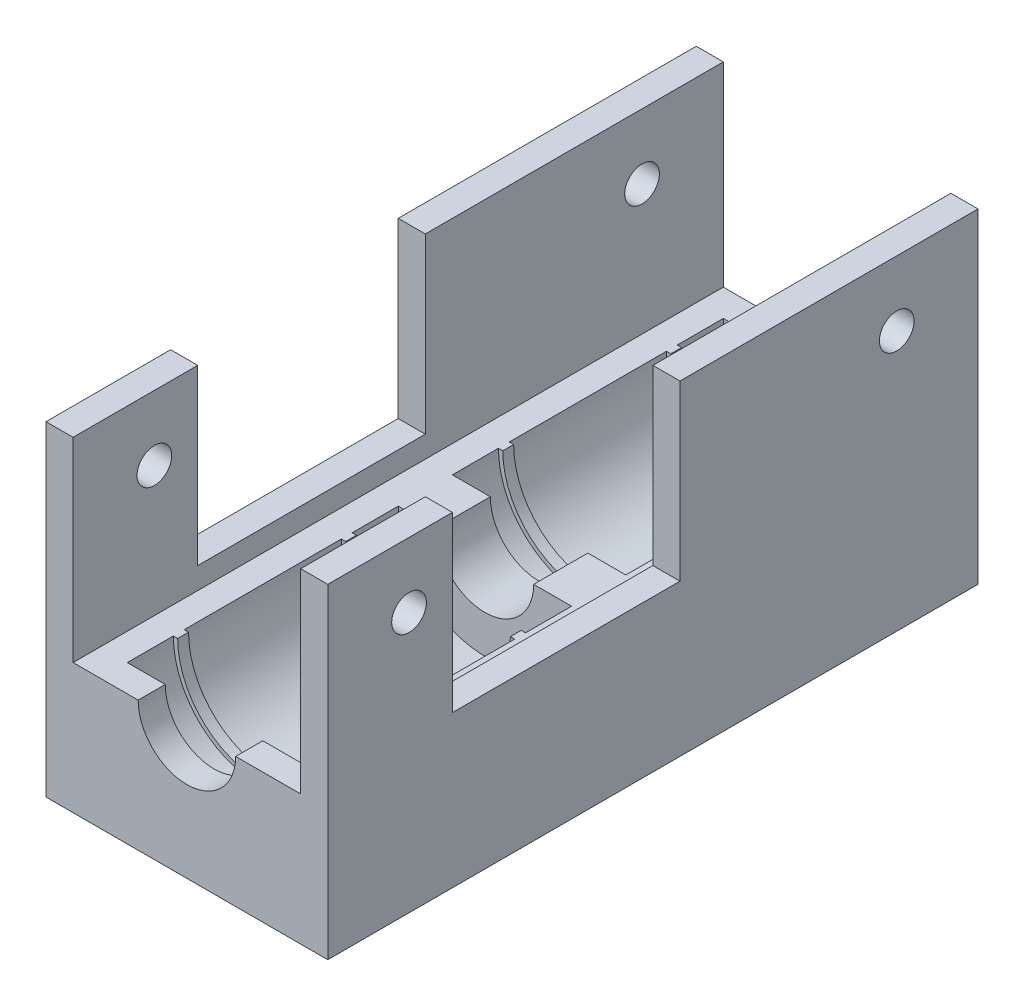
from build123d import *

# Parameters (mm, degrees)
SKETCH1_W           = 21
SKETCH1_H           = 60
BOSS_EXTRUDE1_DEPTH = 12
BOSS_EXTRUDE2_DEPTH = 2.5
SKETCH7_R           = 1.6
CUT_EXTRUDE2_DEPTH  = 50.759421218


with BuildPart() as part:
    # Sketch1 → Boss-Extrude1 (new body)
    with BuildSketch(Plane(origin=(0, 0, 0), x_dir=(1, 0, 0), z_dir=(0, 1, 0))):
        Rectangle(SKETCH1_W, SKETCH1_H)
    extrude(amount=BOSS_EXTRUDE1_DEPTH)

    # Sketch2 → Cut-Revolve1 (revolve, cut)
    with BuildSketch(Plane(origin=(0, 12, 0), x_dir=(1, 0, 0), z_dir=(0, 1, 0))):
        Polygon((0, 30), (4.5, 30), (4.5, 27.5), (8, 27.5), (8, 23.25), (7.6, 23.25), (7.6, 22.25), (8, 22.25), (8, 7.75), (7.6, 7.75), (7.6, 6.75), (8, 6.75), (8, 2.5), (4.5, 2.5), (4.5, -2.5), (8, -2.5), (8, -6.75), (7.6, -6.75), (7.6, -7.75), (8, -7.75), (8, -22.25), (7.6, -22.25), (7.6, -23.25), (8, -23.25), (8, -27.5), (4.5, -27.5), (4.5, -30), (0, -30), align=None)
    revolve(axis=Axis((0, 12, 32.783592288), (0, 0, -1)), mode=Mode.SUBTRACT)

    # Sketch3 → Boss-Extrude2 (add)
    with BuildSketch(Plane.ZY.offset(10.5)):
        Polygon((-30, 0), (-30, 30), (-2.5, 30), (-2.5, 14), (18.5, 14), (18.5, 30), (30, 30), (30, 0), align=None)
    boss_extrude2 = extrude(amount=BOSS_EXTRUDE2_DEPTH)

    # Mirror2: Boss-Extrude2 across plane
    add(boss_extrude2.mirror(Plane(origin=(0, 0, 0), x_dir=(0, 0, 1), z_dir=(1, 0, 0))))

    # Sketch7 → Cut-Extrude2 (cut, through all)
    with BuildSketch(Plane.ZY.offset(13)):
        with Locations((22.5, 24)):
            Circle(SKETCH7_R)
        with Locations((-22.5, 24)):
            Circle(SKETCH7_R)
    extrude(amount=-CUT_EXTRUDE2_DEPTH, mode=Mode.SUBTRACT)


solid = part.part
